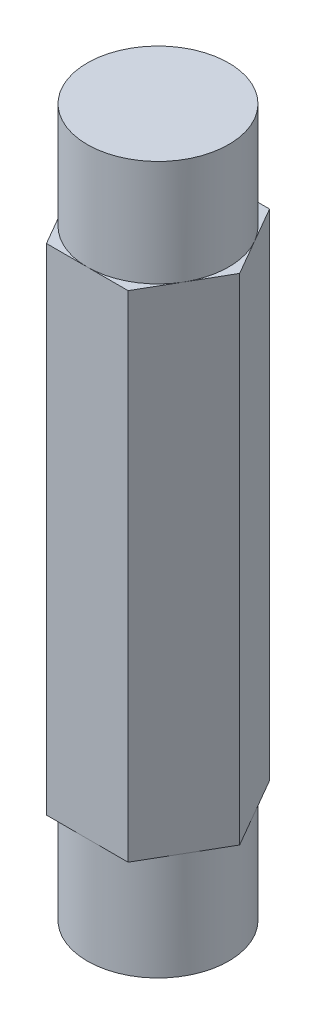
from build123d import *

# Parameters (mm, degrees)
BOSS_EXTRUDE1_DEPTH = 7
SKETCH2_R           = 2
BOSS_EXTRUDE2_DEPTH = 3


with BuildPart() as part:
    # Sketch1 → Boss-Extrude1 (new, symmetric)
    with BuildSketch(Plane(origin=(0, 0, 0), x_dir=(1, 0, 0), z_dir=(0, 1, 0))):
        Polygon((-1.154700538, 2), (-2.309401077, 0), (-1.154700538, -2), (1.154700538, -2), (2.309401077, 0), (1.154700538, 2), align=None)
    extrude(amount=BOSS_EXTRUDE1_DEPTH, both=True)

    # Sketch2 → Boss-Extrude2 (add)
    with BuildSketch(Plane(origin=(0, 7, 0), x_dir=(1, 0, 0), z_dir=(0, 1, 0))):
        with Locations(Location((0, 0, 0), (0, 0, 270))):
            Circle(SKETCH2_R)
    boss_extrude2 = extrude(amount=BOSS_EXTRUDE2_DEPTH)

    # Mirror1: Boss-Extrude2 across plane
    add(boss_extrude2.mirror(Plane.ZX))


solid = part.part
